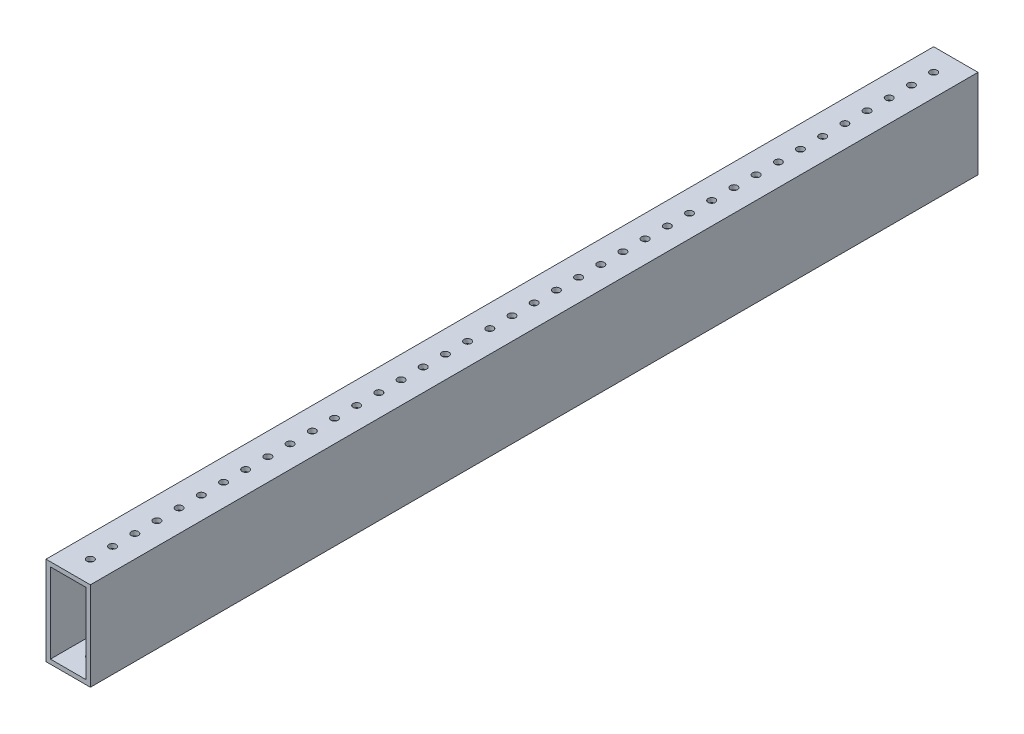
from build123d import *

# Parameters (mm, degrees)
SKETCH1_W           = 25.4
SKETCH1_H           = 50.8
SKETCH1_W_2         = 20.32
SKETCH1_H_2         = 45.72
BOSS_EXTRUDE1_DEPTH = 508
SKETCH2_R           = 2.032
CUT_EXTRUDE1_DEPTH  = 508


with BuildPart() as part:
    # Sketch1 → Boss-Extrude1 (new body)
    with BuildSketch(Plane.XY):
        with Locations((12.7, 25.4)):
            Rectangle(SKETCH1_W, SKETCH1_H)
        with Locations((12.7, 25.4)):
            Rectangle(SKETCH1_W_2, SKETCH1_H_2, mode=Mode.SUBTRACT)
    extrude(amount=BOSS_EXTRUDE1_DEPTH)

    # Sketch2 → Cut-Extrude1 (cut)
    with BuildSketch(Plane(origin=(0, 50.8, 0), x_dir=(1, 0, 0), z_dir=(0, 1, 0))):
        with Locations(Location((12.7, -12.7, 0), (0, 0, 270))):
            Circle(SKETCH2_R)
        with Locations(Location((12.7, -25.4, 0), (0, 0, 270))):
            Circle(SKETCH2_R)
        with Locations(Location((12.7, -38.1, 0), (0, 0, 270))):
            Circle(SKETCH2_R)
        with Locations(Location((12.7, -50.8, 0), (0, 0, 270))):
            Circle(SKETCH2_R)
        with Locations(Location((12.7, -63.5, 0), (0, 0, 270))):
            Circle(SKETCH2_R)
        with Locations(Location((12.7, -76.2, 0), (0, 0, 270))):
            Circle(SKETCH2_R)
        with Locations(Location((12.7, -88.9, 0), (0, 0, 270))):
            Circle(SKETCH2_R)
        with Locations(Location((12.7, -101.6, 0), (0, 0, 270))):
            Circle(SKETCH2_R)
        with Locations(Location((12.7, -114.3, 0), (0, 0, 270))):
            Circle(SKETCH2_R)
        with Locations(Location((12.7, -127, 0), (0, 0, 270))):
            Circle(SKETCH2_R)
        with Locations(Location((12.7, -139.7, 0), (0, 0, 270))):
            Circle(SKETCH2_R)
        with Locations(Location((12.7, -152.4, 0), (0, 0, 270))):
            Circle(SKETCH2_R)
        with Locations(Location((12.7, -165.1, 0), (0, 0, 270))):
            Circle(SKETCH2_R)
        with Locations(Location((12.7, -177.8, 0), (0, 0, 270))):
            Circle(SKETCH2_R)
        with Locations(Location((12.7, -190.5, 0), (0, 0, 270))):
            Circle(SKETCH2_R)
        with Locations(Location((12.7, -203.2, 0), (0, 0, 270))):
            Circle(SKETCH2_R)
        with Locations(Location((12.7, -215.9, 0), (0, 0, 270))):
            Circle(SKETCH2_R)
        with Locations(Location((12.7, -228.6, 0), (0, 0, 270))):
            Circle(SKETCH2_R)
        with Locations(Location((12.7, -241.3, 0), (0, 0, 270))):
            Circle(SKETCH2_R)
        with Locations(Location((12.7, -254, 0), (0, 0, 270))):
            Circle(SKETCH2_R)
        with Locations(Location((12.7, -266.7, 0), (0, 0, 270))):
            Circle(SKETCH2_R)
        with Locations(Location((12.7, -279.4, 0), (0, 0, 270))):
            Circle(SKETCH2_R)
        with Locations(Location((12.7, -292.1, 0), (0, 0, 270))):
            Circle(SKETCH2_R)
        with Locations(Location((12.7, -304.8, 0), (0, 0, 270))):
            Circle(SKETCH2_R)
        with Locations(Location((12.7, -317.5, 0), (0, 0, 270))):
            Circle(SKETCH2_R)
        with Locations(Location((12.7, -330.2, 0), (0, 0, 270))):
            Circle(SKETCH2_R)
        with Locations(Location((12.7, -342.9, 0), (0, 0, 270))):
            Circle(SKETCH2_R)
        with Locations(Location((12.7, -355.6, 0), (0, 0, 270))):
            Circle(SKETCH2_R)
        with Locations(Location((12.7, -368.3, 0), (0, 0, 270))):
            Circle(SKETCH2_R)
        with Locations(Location((12.7, -381, 0), (0, 0, 270))):
            Circle(SKETCH2_R)
        with Locations(Location((12.7, -393.7, 0), (0, 0, 270))):
            Circle(SKETCH2_R)
        with Locations(Location((12.7, -406.4, 0), (0, 0, 270))):
            Circle(SKETCH2_R)
        with Locations(Location((12.7, -419.1, 0), (0, 0, 270))):
            Circle(SKETCH2_R)
        with Locations(Location((12.7, -431.8, 0), (0, 0, 270))):
            Circle(SKETCH2_R)
        with Locations(Location((12.7, -444.5, 0), (0, 0, 270))):
            Circle(SKETCH2_R)
        with Locations(Location((12.7, -457.2, 0), (0, 0, 270))):
            Circle(SKETCH2_R)
        with Locations(Location((12.7, -469.9, 0), (0, 0, 270))):
            Circle(SKETCH2_R)
        with Locations(Location((12.7, -482.6, 0), (0, 0, 270))):
            Circle(SKETCH2_R)
        with Locations(Location((12.7, -495.3, 0), (0, 0, 270))):
            Circle(SKETCH2_R)
    extrude(amount=-CUT_EXTRUDE1_DEPTH, mode=Mode.SUBTRACT)


solid = part.part
